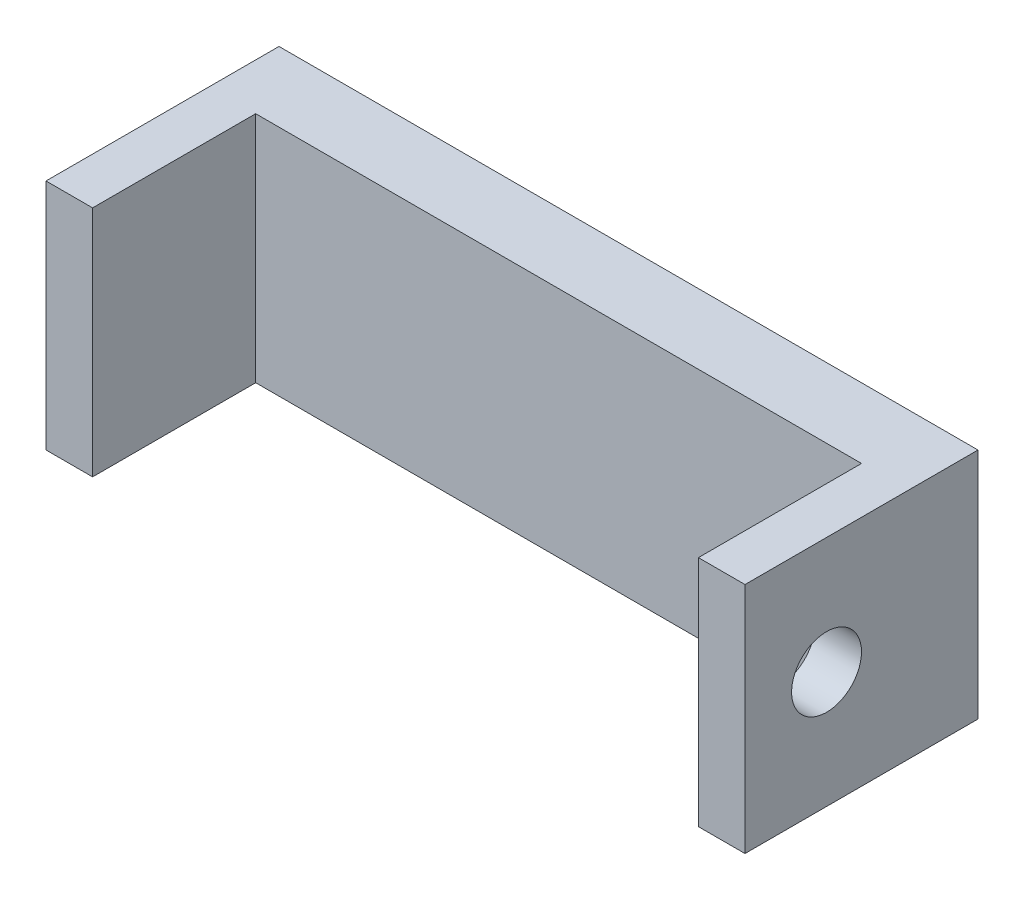
from build123d import *

# Parameters (mm, degrees)
SKETCH_1_W          = 30
SKETCH_1_H          = 10
EXTRUDE_1_DEPTH     = 1.5
SKETCH_2_W          = 2
SKETCH_2_H          = 10
EXTRUDE_2_DEPTH     = 7
CUT_EXTRUDE_1_REACH = 33.579
SKETCH_3_R          = 1.5


with BuildPart() as part:
    # 草图1 → 凸台-拉伸1 (new, symmetric)
    with BuildSketch(Plane.XY):
        Rectangle(SKETCH_1_W, SKETCH_1_H)
    extrude(amount=EXTRUDE_1_DEPTH, both=True)

    # 草图2 → 凸台-拉伸2 (add)
    with BuildSketch(Plane.XY.offset(1.5)):
        with Locations((-14, 0)):
            Rectangle(SKETCH_2_W, SKETCH_2_H)
        with Locations((14, 0)):
            Rectangle(SKETCH_2_W, SKETCH_2_H)
    extrude(amount=EXTRUDE_2_DEPTH)

    # 草图3 → 切除-拉伸1 (cut, up to next)
    with BuildSketch(Plane(origin=(15, 0, 0), x_dir=(0, 0, -1), z_dir=(1, 0, 0)), mode=Mode.PRIVATE) as cut_extrude_1_sk1:
        with Locations((-5, 0)):
            Circle(SKETCH_3_R)
    cut_extrude_1_tool1 = extrude(cut_extrude_1_sk1.sketch, amount=-CUT_EXTRUDE_1_REACH, mode=Mode.PRIVATE) & part.part
    add(cut_extrude_1_tool1.solids().sort_by_distance((15, 0, 5))[0], mode=Mode.SUBTRACT)


solid = part.part
